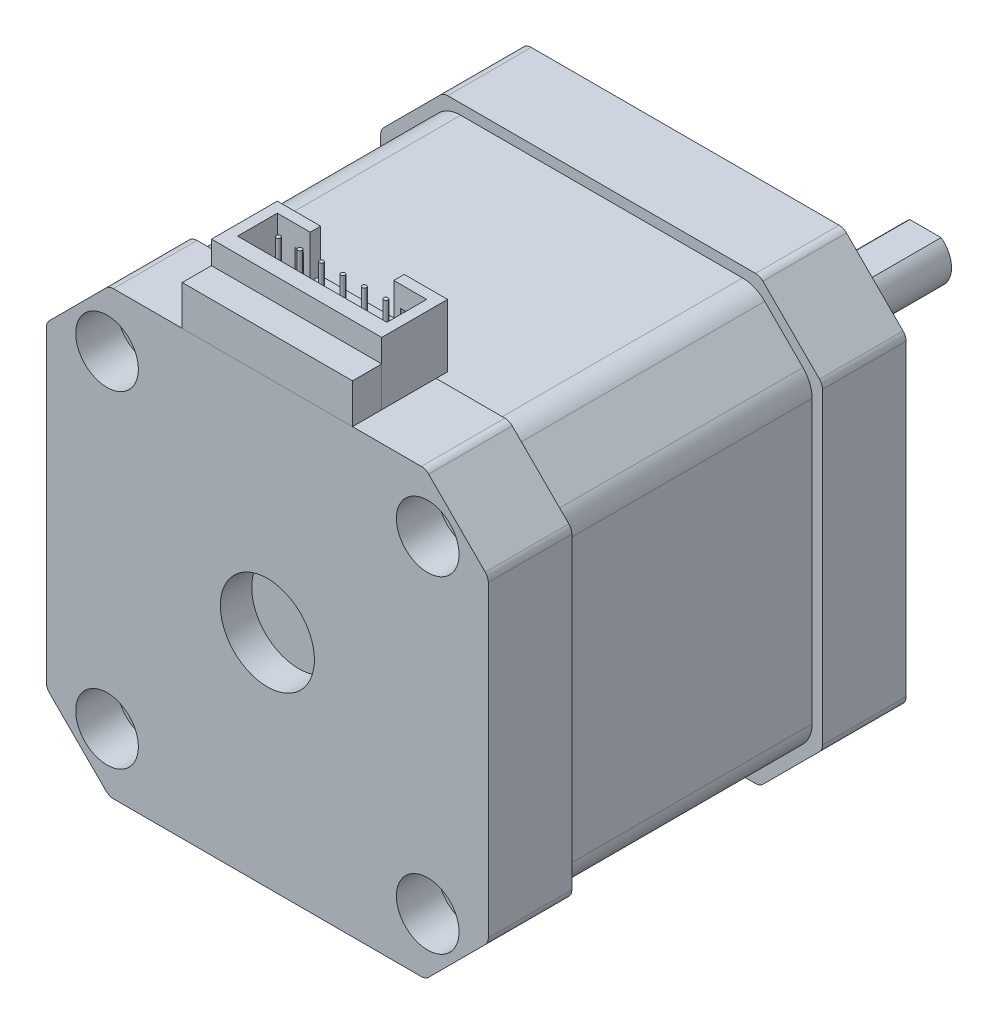
from build123d import *

# Parameters (mm, degrees)
SKETCH1_W            = 42.3
SKETCH1_H            = 42.3
BOSS_EXTRUDE1_DEPTH  = 8
CHAMFER1_SIZE        = 6
FILLET1_R            = 1
BOSS_EXTRUDE4_DEPTH  = 24
FILLET2_R            = 3
BOSS_EXTRUDE5_DEPTH  = 8
SKETCH7_R            = 1.5
CUT_EXTRUDE1_DEPTH   = 50.946421293
SKETCH8_R            = 4.5
CUT_EXTRUDE2_DEPTH   = 50.946421293
BOSS_EXTRUDE7_START  = 1.8
SKETCH9_R            = 11
SKETCH9_R_2          = 4.5
BOSS_EXTRUDE7_DEPTH  = 1.8
FILLET4_R            = 0.5
FILLET5_R            = 0.2
SKETCH12_R           = 4.5
BOSS_EXTRUDE8_DEPTH  = 10
SKETCH16_R           = 2.5
BOSS_EXTRUDE9_DEPTH  = 50
CUT_EXTRUDE10_DEPTH  = 20
SKETCH24_W           = 16.3
SKETCH24_H           = 3.8
BOSS_EXTRUDE17_DEPTH = 2.8
SKETCH25_W           = 16.3
SKETCH25_H           = 6
BOSS_EXTRUDE18_DEPTH = 6.3
SKETCH26_W           = 8
SKETCH26_H           = 4.1
CUT_EXTRUDE6_DEPTH   = 4
SKETCH28_W           = 14.3
SKETCH28_H           = 3.8
CUT_EXTRUDE7_DEPTH   = 5
CUT_EXTRUDE8_DEPTH   = 1
SKETCH29_R           = 0.2
BOSS_EXTRUDE19_DEPTH = 5
SKETCH30_R           = 3
SKETCH30_R_2         = 1.5
CUT_EXTRUDE9_DEPTH   = 4


with BuildPart() as part:
    # Sketch1 → Boss-Extrude1 (new body)
    with BuildSketch(Plane.XY):
        Rectangle(SKETCH1_W, SKETCH1_H)
    extrude(amount=BOSS_EXTRUDE1_DEPTH)

    # Chamfer1
    chamfer1_edges = [part.edges().sort_by_distance(p)[0] for p in [
        (-21.15, -21.15, 4),
        (21.15, -21.15, 4),
        (21.15, 21.15, 4),
        (-21.15, 21.15, 4),
    ]]
    chamfer(chamfer1_edges, length=CHAMFER1_SIZE)

    # Fillet1
    fillet1_edges = [part.edges().sort_by_distance(p)[0] for p in [
        (-15.15, 21.15, 4),
        (-21.15, 15.15, 4),
        (-21.15, -15.15, 4),
        (-15.15, -21.15, 4),
        (15.15, -21.15, 4),
        (21.15, -15.15, 4),
        (21.15, 15.15, 4),
        (15.15, 21.15, 4),
    ]]
    fillet(fillet1_edges, radius=FILLET1_R)


with BuildPart() as body_2:
    # Sketch3 → Boss-Extrude4 (new body)
    with BuildSketch(Plane(origin=(0, 0, 0), x_dir=(-1, 0, 0), z_dir=(0, 0, -1))):
        Polygon((-14.735786438, 20.15), (14.735786438, 20.15), (20.15, 14.735786438), (20.15, -14.735786438), (14.735786438, -20.15), (-14.735786438, -20.15), (-20.15, -14.735786438), (-20.15, 14.735786438), align=None)
    extrude(amount=BOSS_EXTRUDE4_DEPTH)

    # Fillet2
    fillet2_edges = [body_2.edges().sort_by_distance(p)[0] for p in [
        (20.15, -14.735786438, -12),
        (14.735786438, -20.15, -12),
        (-14.735786438, -20.15, -12),
        (-20.15, -14.735786438, -12),
        (-20.15, 14.735786438, -12),
        (-14.735786438, 20.15, -12),
        (20.15, 14.735786438, -12),
        (14.735786438, 20.15, -12),
    ]]
    fillet(fillet2_edges, radius=FILLET2_R)


with BuildPart() as body_3:
    # Sketch6 → Boss-Extrude5 (new body)
    with BuildSketch(Plane(origin=(0, 0, -24), x_dir=(-1, 0, 0), z_dir=(0, 0, -1))):
        with BuildLine():
            Line((15.442893219, -20.857106781), (20.857106781, -15.442893219))
            ThreePointArc((20.857106781, -15.442893219), (21.073879533, -15.11846987), (21.15, -14.735786438))
            Line((21.15, -14.735786438), (21.15, 14.735786438))
            ThreePointArc((21.15, 14.735786438), (21.073879533, 15.11846987), (20.857106781, 15.442893219))
            Line((20.857106781, 15.442893219), (15.442893219, 20.857106781))
            ThreePointArc((15.442893219, 20.857106781), (15.11846987, 21.073879533), (14.735786438, 21.15))
            Line((14.735786438, 21.15), (-14.735786438, 21.15))
            ThreePointArc((-14.735786438, 21.15), (-15.11846987, 21.073879533), (-15.442893219, 20.857106781))
            Line((-15.442893219, 20.857106781), (-20.857106781, 15.442893219))
            ThreePointArc((-20.857106781, 15.442893219), (-21.073879533, 15.11846987), (-21.15, 14.735786438))
            Line((-21.15, 14.735786438), (-21.15, -14.735786438))
            ThreePointArc((-21.15, -14.735786438), (-21.073879533, -15.11846987), (-20.857106781, -15.442893219))
            Line((-20.857106781, -15.442893219), (-15.442893219, -20.857106781))
            ThreePointArc((-15.442893219, -20.857106781), (-15.11846987, -21.073879533), (-14.735786438, -21.15))
            Line((-14.735786438, -21.15), (14.735786438, -21.15))
            ThreePointArc((14.735786438, -21.15), (15.11846987, -21.073879533), (15.442893219, -20.857106781))
        make_face()
    extrude(amount=BOSS_EXTRUDE5_DEPTH)


with BuildPart() as cut_extrude1_tool:
    # Sketch7 → Cut-Extrude1 (new, through all)
    with BuildSketch(Plane.XY.offset(8)):
        with Locations((-15.35, 15.65)):
            Circle(SKETCH7_R)
        with Locations((15.35, 15.65)):
            Circle(SKETCH7_R)
        with Locations((15.35, -15.65)):
            Circle(SKETCH7_R)
        with Locations((-15.35, -15.65)):
            Circle(SKETCH7_R)
    extrude(amount=-CUT_EXTRUDE1_DEPTH)


with BuildPart() as part_1:
    add(part.part)

    # Cut-Extrude1: cut by cut_extrude1_tool
    add(cut_extrude1_tool.part, mode=Mode.SUBTRACT)


with BuildPart() as body_2_1:
    add(body_2.part)

    # Cut-Extrude1: cut by cut_extrude1_tool
    add(cut_extrude1_tool.part, mode=Mode.SUBTRACT)


with BuildPart() as body_3_1:
    add(body_3.part)

    # Cut-Extrude1: cut by cut_extrude1_tool
    add(cut_extrude1_tool.part, mode=Mode.SUBTRACT)


with BuildPart() as cut_extrude2_tool:
    # Sketch8 → Cut-Extrude2 (new, through all)
    with BuildSketch(Plane(origin=(0, 0, -32), x_dir=(-1, 0, 0), z_dir=(0, 0, -1))):
        Circle(SKETCH8_R)
    extrude(amount=-CUT_EXTRUDE2_DEPTH)


with BuildPart() as part_2:
    add(part_1.part)

    # Cut-Extrude2: cut by cut_extrude2_tool
    add(cut_extrude2_tool.part, mode=Mode.SUBTRACT)

    # Sketch30 → Cut-Extrude9 (cut)
    # profile 1 of 4: a face of its own
    with BuildSketch(Plane.XY.offset(8)):
        with Locations((-15.35, 15.65)):
            Circle(SKETCH30_R)
        with Locations((-15.35, 15.65)):
            Circle(SKETCH30_R_2, mode=Mode.SUBTRACT)
    # profile 2 of 4: a face of its own
    with BuildSketch(Plane.XY.offset(8)):
        with Locations((15.35, 15.65)):
            Circle(SKETCH30_R)
        with Locations((15.35, 15.65)):
            Circle(SKETCH30_R_2, mode=Mode.SUBTRACT)
    # profile 3 of 4: a face of its own
    with BuildSketch(Plane.XY.offset(8)):
        with Locations((15.35, -15.65)):
            Circle(SKETCH30_R)
        with Locations((15.35, -15.65)):
            Circle(SKETCH30_R_2, mode=Mode.SUBTRACT)
    # profile 4 of 4: a face of its own
    with BuildSketch(Plane.XY.offset(8)):
        with Locations((-15.35, -15.65)):
            Circle(SKETCH30_R)
        with Locations((-15.35, -15.65)):
            Circle(SKETCH30_R_2, mode=Mode.SUBTRACT)
    extrude(amount=-CUT_EXTRUDE9_DEPTH, mode=Mode.SUBTRACT)


with BuildPart() as body_2_2:
    add(body_2_1.part)

    # Cut-Extrude2: cut by cut_extrude2_tool
    add(cut_extrude2_tool.part, mode=Mode.SUBTRACT)



with BuildPart() as body_3_2:
    add(body_3_1.part)

    # Cut-Extrude2: cut by cut_extrude2_tool
    add(cut_extrude2_tool.part, mode=Mode.SUBTRACT)

    # Sketch9 → Boss-Extrude7 (add)
    with BuildSketch(Plane(origin=(0, 0, -32), x_dir=(-1, 0, 0), z_dir=(0, 0, -1)).offset(BOSS_EXTRUDE7_START)):
        Circle(SKETCH9_R)
        Circle(SKETCH9_R_2, mode=Mode.SUBTRACT)
    extrude(amount=-BOSS_EXTRUDE7_DEPTH)

    # Fillet4
    fillet4_edges = [body_3_2.edges().sort_by_distance(p)[0] for p in [
        (11, 0, -32),
    ]]
    fillet(fillet4_edges, radius=FILLET4_R)

    # Fillet5
    fillet5_edges = [body_3_2.edges().sort_by_distance(p)[0] for p in [
        (11, 0, -33.8),
    ]]
    fillet(fillet5_edges, radius=FILLET5_R)


with BuildPart() as body_4:
    # Sketch12 → Boss-Extrude8 (new body)
    with BuildSketch(Plane.XY.offset(5)):
        Circle(SKETCH12_R)
    extrude(amount=-BOSS_EXTRUDE8_DEPTH)


with BuildPart() as body_2_3:
    add(body_2_2.part)

    add(body_3_2.part)  # Boss-Extrude9 merges body 3

    add(body_4.part)  # Boss-Extrude9 merges body 4
    # Sketch16 → Boss-Extrude9 (add)
    with BuildSketch(Plane(origin=(0, 0, -5), x_dir=(-1, 0, 0), z_dir=(0, 0, -1))):
        Circle(SKETCH16_R)
    extrude(amount=BOSS_EXTRUDE9_DEPTH)

    # Sketch17 → Cut-Extrude10 (cut)
    with BuildSketch(Plane(origin=(0, 0, -55), x_dir=(-1, 0, 0), z_dir=(0, 0, -1))):
        with BuildLine():
            Line((-1.5, 2), (1.5, 2))
            ThreePointArc((1.5, 2), (0, 2.5), (-1.5, 2))
        make_face()
    extrude(amount=-CUT_EXTRUDE10_DEPTH, mode=Mode.SUBTRACT)


with BuildPart() as body_3_2_1:
    # Sketch24 → Boss-Extrude17 (new body)
    with BuildSketch(Plane.XY.offset(8)):
        with Locations((0, 23.05)):
            Rectangle(SKETCH24_W, SKETCH24_H)
    extrude(amount=-BOSS_EXTRUDE17_DEPTH)


with BuildPart() as body_4_2:
    # Sketch25 → Boss-Extrude18 (new body)
    with BuildSketch(Plane(origin=(0, 0, 5.2), x_dir=(-1, 0, 0), z_dir=(0, 0, -1))):
        with Locations((0, 24.15)):
            Rectangle(SKETCH25_W, SKETCH25_H)
    extrude(amount=BOSS_EXTRUDE18_DEPTH)

    # Sketch26 → Cut-Extrude6 (cut)
    with BuildSketch(Plane(origin=(0, 0, -1.1), x_dir=(-1, 0, 0), z_dir=(0, 0, -1))):
        with Locations((0, 25.1)):
            Rectangle(SKETCH26_W, SKETCH26_H)
    extrude(amount=-CUT_EXTRUDE6_DEPTH, mode=Mode.SUBTRACT)

    # Sketch28 → Cut-Extrude7 (cut)
    with BuildSketch(Plane(origin=(0, 27.15, 0), x_dir=(1, 0, 0), z_dir=(0, 1, 0))):
        with Locations((0, -1.8)):
            Rectangle(SKETCH28_W, SKETCH28_H)
    extrude(amount=-CUT_EXTRUDE7_DEPTH, mode=Mode.SUBTRACT)

    # Sketch26<4> → Cut-Extrude8 (cut)
    with BuildSketch(Plane(origin=(0, 0, -1.1), x_dir=(-1, 0, 0), z_dir=(0, 0, -1))):
        Polygon((-5.45, 25.15), (-5.45, 21.15), (5.45, 21.15), (5.45, 25.15), (4.65, 25.15), (4.65, 21.65), (-4.65, 21.65), (-4.65, 25.15), align=None)
    extrude(amount=-CUT_EXTRUDE8_DEPTH, mode=Mode.SUBTRACT)

    # Sketch29 → Boss-Extrude19 (add)
    with BuildSketch(Plane(origin=(0, 22.15, 0), x_dir=(1, 0, 0), z_dir=(0, 1, 0))):
        with Locations((-5.147005039, -1.8)):
            Circle(SKETCH29_R)
        with Locations((-3.088203024, -1.8)):
            Circle(SKETCH29_R)
        with Locations((-1.029401008, -1.8)):
            Circle(SKETCH29_R)
        with Locations((1.029401008, -1.8)):
            Circle(SKETCH29_R)
        with Locations((3.088203024, -1.8)):
            Circle(SKETCH29_R)
        with Locations((5.147005039, -1.8)):
            Circle(SKETCH29_R)
    extrude(amount=BOSS_EXTRUDE19_DEPTH)


solid = Compound([part_2.part, body_2_3.part, body_3_2_1.part, body_4_2.part])
